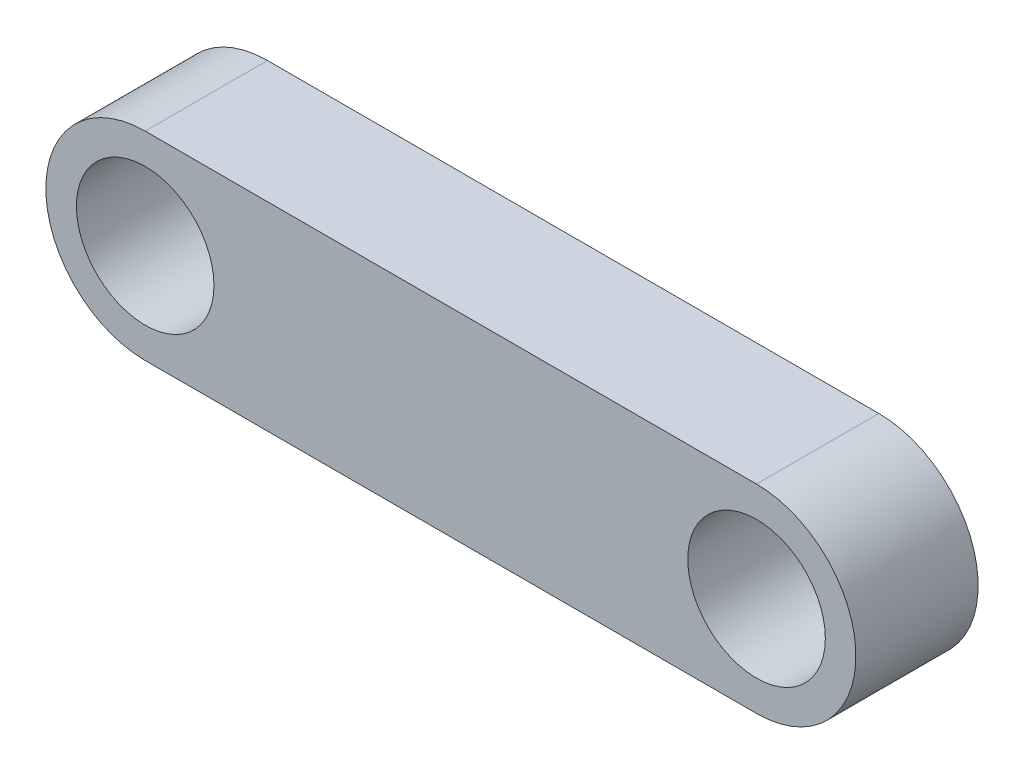
from build123d import *

# Parameters (mm, degrees)
SKETCH1_R           = 2.25
BOSS_EXTRUDE1_DEPTH = 2


with BuildPart() as part:
    # Sketch1 → Boss-Extrude1 (new, symmetric)
    with BuildSketch(Plane.XY):
        with BuildLine():
            Line((0, 3.25), (20, 3.25))
            ThreePointArc((20, 3.25), (23.25, 0), (20, -3.25))
            Line((20, -3.25), (0, -3.25))
            ThreePointArc((0, -3.25), (-3.25, 0), (0, 3.25))
        make_face()
        Circle(SKETCH1_R, mode=Mode.SUBTRACT)
        with Locations((20, 0)):
            Circle(SKETCH1_R, mode=Mode.SUBTRACT)
    extrude(amount=BOSS_EXTRUDE1_DEPTH, both=True)


solid = part.part
